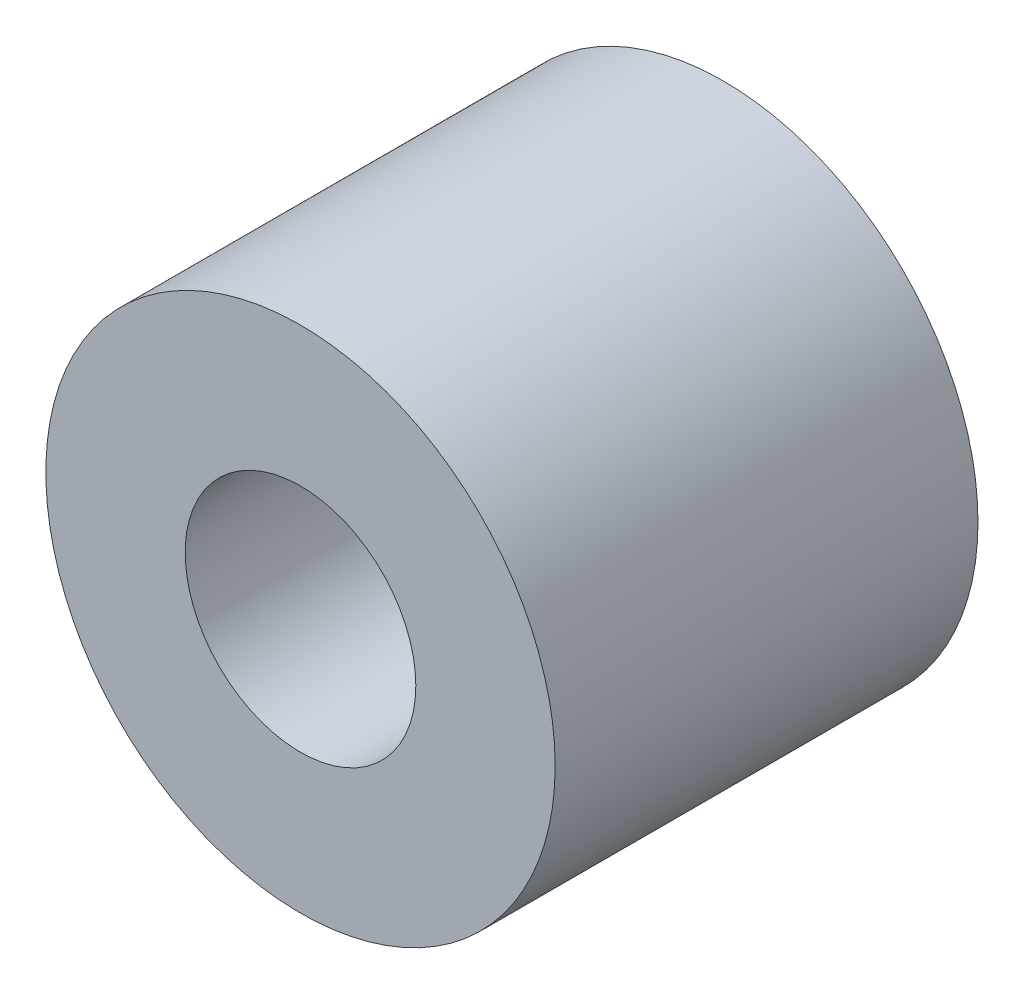
from build123d import *

# Parameters (mm, degrees)
SKETCH1_R           = 26.5
BOSS_EXTRUDE1_DEPTH = 44
SKETCH2_R           = 12
CUT_EXTRUDE1_DEPTH  = 58.797058749


with BuildPart() as part:
    # Sketch1 → Boss-Extrude1 (new body)
    with BuildSketch(Plane.XY):
        Circle(SKETCH1_R)
    extrude(amount=BOSS_EXTRUDE1_DEPTH)

    # Sketch2 → Cut-Extrude1 (cut, through all)
    with BuildSketch(Plane.XY.offset(44)):
        Circle(SKETCH2_R)
    extrude(amount=-CUT_EXTRUDE1_DEPTH, mode=Mode.SUBTRACT)


solid = part.part
